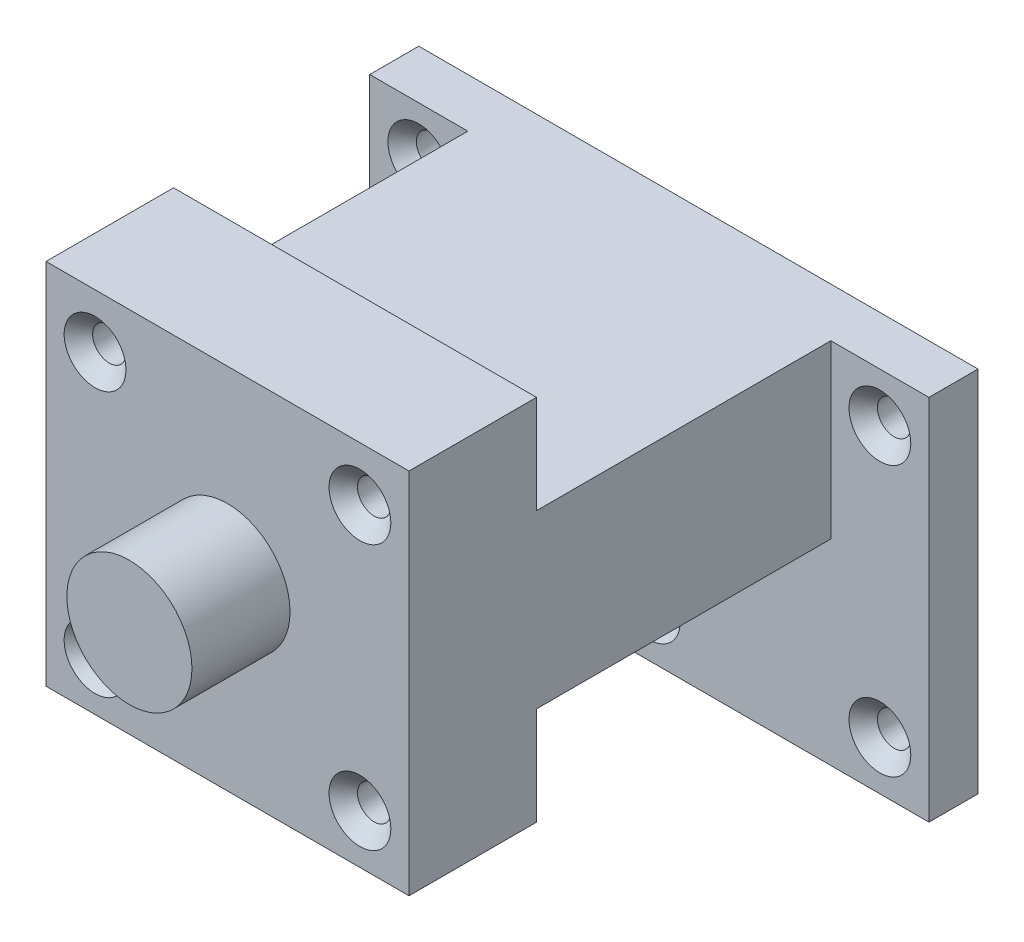
from build123d import *

# Parameters (mm, degrees)
ESQUISSE1_W                                       = 37
ESQUISSE1_H                                       = 37.5
BOSS_EXTRU_1_DEPTH                                = 48
ESQUISSE2_R                                       = 6.375
BOSS_EXTRU_2_DEPTH                                = 10
ENL_V_START                                       = -5
ESQUISSE10_W                                      = 10
ESQUISSE10_H                                      = 10
ESQUISSE10_W_2                                    = 37
ENL_V_MAT_EXTRU_1_DEPTH                           = 30
FRAISAGE_POUR_VIS_T_TE_FRAIS_E_BOMB_E_D           = 3.4
FRAISAGE_POUR_VIS_T_TE_FRAIS_E_BOMB_E_DEPTH       = 13
FRAISAGE_POUR_VIS_T_TE_FRAIS_E_BOMB_E_CSINK_D     = 6.3
FRAISAGE_POUR_VIS_T_TE_FRAIS_E_BOMB_E_CSINK_ANGLE = 90
FRAISAGE_POUR_VIS_T_TE_FRAIS_E_BOMB_E_TIP         = 1.021463052
BOSS_EXTRU_5_DEPTH                                = 5
ESQUISSE12_W                                      = 37
ESQUISSE12_H                                      = 10
ENL_V_MAT_EXTRU_2_DEPTH                           = 5
FRAISAGE_POUR_VIS_T_TE_FRAIS_E_BOM_2_D            = 3.4
FRAISAGE_POUR_VIS_T_TE_FRAIS_E_BOM_2_DEPTH        = 5
FRAISAGE_POUR_VIS_T_TE_FRAIS_E_BOM_2_CSINK_D      = 6.3
FRAISAGE_POUR_VIS_T_TE_FRAIS_E_BOM_2_CSINK_ANGLE  = 90
FRAISAGE_POUR_VIS_T_TE_FRAIS_E_BOM_2_TIP          = 1.021463052


with BuildPart() as part:
    # Esquisse1 → Boss.-Extru.1 (new body)
    with BuildSketch(Plane.XY):
        with Locations((18.5, 18.75)):
            Rectangle(ESQUISSE1_W, ESQUISSE1_H)
    extrude(amount=BOSS_EXTRU_1_DEPTH)

    # Esquisse2 → Boss.-Extru.2 (add)
    with BuildSketch(Plane.XY.offset(48)):
        with Locations((18.5, 19)):
            Circle(ESQUISSE2_R)
    extrude(amount=BOSS_EXTRU_2_DEPTH)

    # Esquisse10 → Enlèv. mat.-Extru.1 (cut)
    with BuildSketch(Plane(origin=(0, 0, 0), x_dir=(-1, 0, 0), z_dir=(0, 0, -1)).offset(ENL_V_START)):
        with Locations((-32, 5)):
            Rectangle(ESQUISSE10_W, ESQUISSE10_H)
        with Locations((-18.5, 32.5)):
            Rectangle(ESQUISSE10_W_2, ESQUISSE10_H)
        with Locations((-5, 5)):
            Rectangle(ESQUISSE10_W, ESQUISSE10_H)
    extrude(amount=-ENL_V_MAT_EXTRU_1_DEPTH, mode=Mode.SUBTRACT)

    # Fraisage pour vis _ t_te frais_e bomb_e
    with Locations(Plane.XY.offset(48)):
        with Locations((5, 32), (32, 32), (32, 5), (5, 5)):
            CounterSinkHole(FRAISAGE_POUR_VIS_T_TE_FRAIS_E_BOMB_E_D / 2, FRAISAGE_POUR_VIS_T_TE_FRAIS_E_BOMB_E_CSINK_D / 2, depth=FRAISAGE_POUR_VIS_T_TE_FRAIS_E_BOMB_E_DEPTH, counter_sink_angle=FRAISAGE_POUR_VIS_T_TE_FRAIS_E_BOMB_E_CSINK_ANGLE)
            with Locations((0, 0, -(FRAISAGE_POUR_VIS_T_TE_FRAIS_E_BOMB_E_DEPTH + FRAISAGE_POUR_VIS_T_TE_FRAIS_E_BOMB_E_TIP / 2))):  # 118° drill point
                Cone(0, FRAISAGE_POUR_VIS_T_TE_FRAIS_E_BOMB_E_D / 2, FRAISAGE_POUR_VIS_T_TE_FRAIS_E_BOMB_E_TIP, mode=Mode.SUBTRACT)

    # Esquisse11 → Boss.-Extru.5 (add)
    with BuildSketch(Plane(origin=(0, 0, 0), x_dir=(-1, 0, 0), z_dir=(0, 0, -1))):
        Polygon((-37, 27.5), (-47, 27.5), (-47, -10), (10, -10), (10, 27.5), (0, 27.5), (0, 0), (-37, 0), align=None)
    extrude(amount=-BOSS_EXTRU_5_DEPTH)

    # Esquisse12 → Enlèv. mat.-Extru.2 (cut)
    with BuildSketch(Plane(origin=(0, 0, 0), x_dir=(-1, 0, 0), z_dir=(0, 0, -1))):
        with Locations((-18.5, 32.5)):
            Rectangle(ESQUISSE12_W, ESQUISSE12_H)
    extrude(amount=-ENL_V_MAT_EXTRU_2_DEPTH, mode=Mode.SUBTRACT)

    # Fraisage pour vis _ t_te frais_e bom 2
    with Locations(Plane.XY.offset(5)):
        with Locations((-5, 22.5), (-5, -5), (18.5, -5), (42, -5), (42, 22.5)):
            CounterSinkHole(FRAISAGE_POUR_VIS_T_TE_FRAIS_E_BOM_2_D / 2, FRAISAGE_POUR_VIS_T_TE_FRAIS_E_BOM_2_CSINK_D / 2, depth=FRAISAGE_POUR_VIS_T_TE_FRAIS_E_BOM_2_DEPTH, counter_sink_angle=FRAISAGE_POUR_VIS_T_TE_FRAIS_E_BOM_2_CSINK_ANGLE)
            with Locations((0, 0, -(FRAISAGE_POUR_VIS_T_TE_FRAIS_E_BOM_2_DEPTH + FRAISAGE_POUR_VIS_T_TE_FRAIS_E_BOM_2_TIP / 2))):  # 118° drill point
                Cone(0, FRAISAGE_POUR_VIS_T_TE_FRAIS_E_BOM_2_D / 2, FRAISAGE_POUR_VIS_T_TE_FRAIS_E_BOM_2_TIP, mode=Mode.SUBTRACT)


solid = part.part
